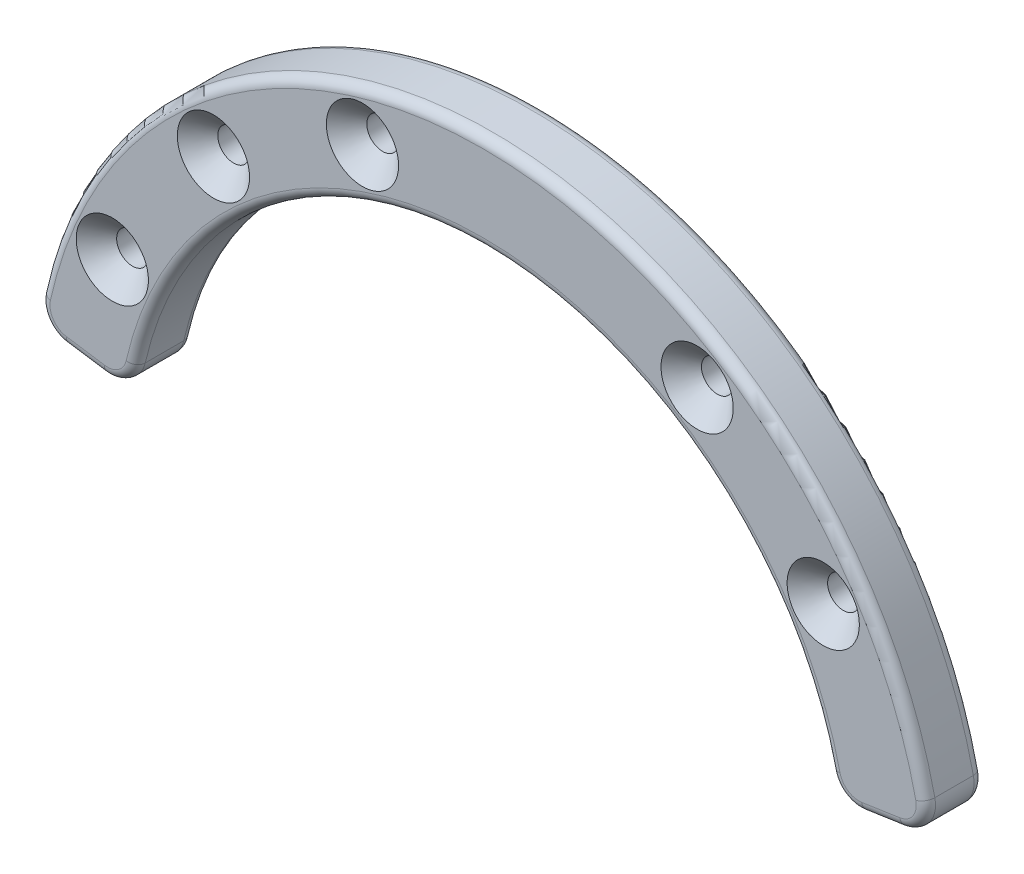
from build123d import *

# Parameters (mm, degrees)
EXTRUDE_1_DEPTH           = 6
FILLET_1_R                = 3
HOLE_WIZARD_1_D           = 3.3
HOLE_WIZARD_1_DEPTH       = 7.5
HOLE_WIZARD_1_CSINK_D     = 7.5
HOLE_WIZARD_1_CSINK_ANGLE = 90
HOLE_WIZARD_1_TIP         = 0.991420021
FILLET_2_R                = 1


with BuildPart() as part:
    # 草图1 → 凸台-拉伸1 (new body)
    with BuildSketch(Plane.XY):
        with BuildLine():
            Line((-36.593586944, 5.468948212), (-46.483745578, 6.947042323))
            ThreePointArc((-46.483745578, 6.947042323), (0, 47), (46.483745578, 6.947042323))
            Line((46.483745578, 6.947042323), (36.593586944, 5.468948212))
            ThreePointArc((36.593586944, 5.468948212), (0, 37), (-36.593586944, 5.468948212))
        make_face()
    extrude(amount=EXTRUDE_1_DEPTH)

    # 圆角1
    fillet_1_edges = [part.edges().sort_by_distance(p)[0] for p in [
        (46.483745578, 6.947042323, 3),
        (36.593586944, 5.468948212, 3),
        (-36.593586944, 5.468948212, 3),
        (-46.483745578, 6.947042323, 3),
    ]]
    fillet(fillet_1_edges, radius=FILLET_1_R)

    # 打孔尺寸(%根据)内六角花形半沉头螺钉的类型1
    with Locations(Plane.XY.offset(6)):
        with Locations((-38.497337773, 16.790620208), (-27.999109004, 31.305656064), (-12.526872455, 40.088366806), (22.222162979, 35.639001962), (35.316348104, 22.730988481)):
            CounterSinkHole(HOLE_WIZARD_1_D / 2, HOLE_WIZARD_1_CSINK_D / 2, depth=HOLE_WIZARD_1_DEPTH, counter_sink_angle=HOLE_WIZARD_1_CSINK_ANGLE)
            with Locations((0, 0, -(HOLE_WIZARD_1_DEPTH + HOLE_WIZARD_1_TIP / 2))):  # 118° drill point
                Cone(0, HOLE_WIZARD_1_D / 2, HOLE_WIZARD_1_TIP, mode=Mode.SUBTRACT)

    # 圆角2
    fillet_2_edges = [part.edges().sort_by_distance(p)[0] for p in [
        (41.432322076, 6.192102022, 0),
        (41.432322076, 6.192102022, 6),
        (0, 47, 0),
        (0, 37, 0),
        (-41.432322076, 6.192102022, 0),
        (-37.313071306, 6.385935339, 0),
        (-45.443039337, 7.754357798, 0),
        (45.443039337, 7.754357798, 0),
        (37.313071306, 6.385935339, 0),
        (0, 37, 6),
        (0, 47, 6),
        (-41.432322076, 6.192102022, 6),
        (-37.313071306, 6.385935339, 6),
        (-45.443039337, 7.754357798, 6),
        (45.443039337, 7.754357798, 6),
        (37.313071306, 6.385935339, 6),
    ]]
    fillet(fillet_2_edges, radius=FILLET_2_R)


solid = part.part
